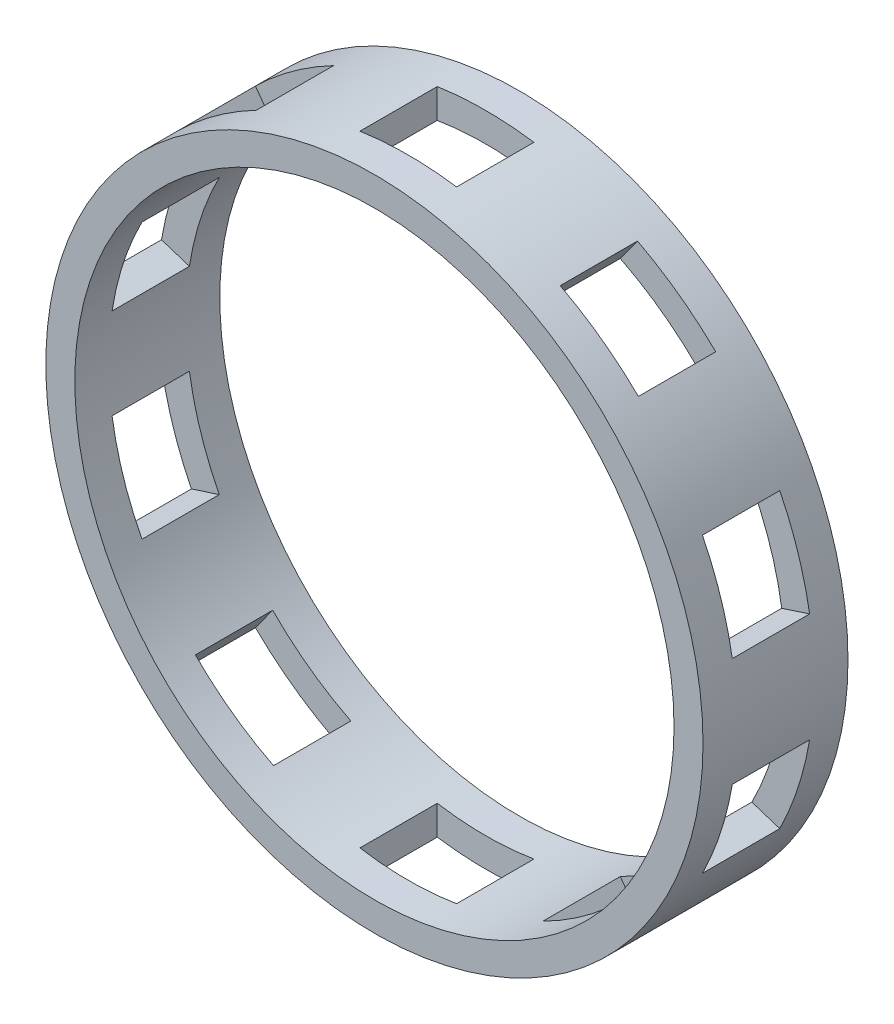
from build123d import *

# Parameters (mm, degrees)
SKETCH1_R           = 68
SKETCH1_R_2         = 62
BOSS_EXTRUDE1_DEPTH = 30
SKETCH2_W           = 20
SKETCH2_H           = 16
CUT_EXTRUDE1_DEPTH  = 101.737282076
CIRPATTERN1_COUNT   = 5


with BuildPart() as part:
    # Sketch1 → Boss-Extrude1 (new body)
    with BuildSketch(Plane.XY):
        Circle(SKETCH1_R)
        Circle(SKETCH1_R_2, mode=Mode.SUBTRACT)
    extrude(amount=BOSS_EXTRUDE1_DEPTH)

    # Sketch2 → Cut-Extrude1 (cut, symmetric)
    with BuildSketch(Plane(origin=(0, 0, 0), x_dir=(1, 0, 0), z_dir=(0, 1, 0))):
        with Locations((0, -15)):
            Rectangle(SKETCH2_W, SKETCH2_H)
    cut_extrude1 = extrude(amount=CUT_EXTRUDE1_DEPTH, both=True, mode=Mode.SUBTRACT)

    # CirPattern1: Cut-Extrude1 ×5 about axis
    cirpattern1_axis = Axis((0, 0, 0), (0, 0, 1))
    for i in range(1, CIRPATTERN1_COUNT):
        add(cut_extrude1.rotate(cirpattern1_axis, i * 360 / CIRPATTERN1_COUNT), mode=Mode.SUBTRACT)


solid = part.part
